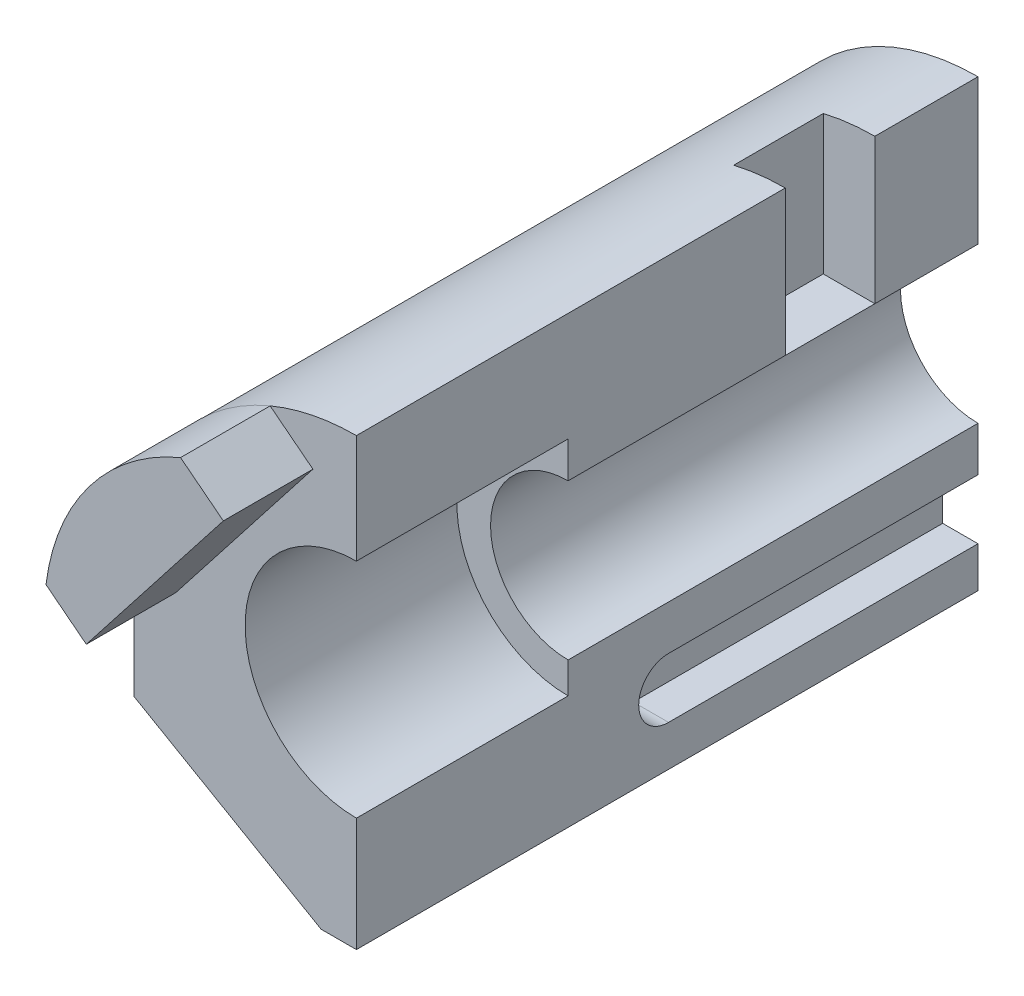
from build123d import *

# Parameters (mm, degrees)
BOSS_EXTRUDE1_DEPTH = 229
BOSS_EXTRUDE3_DEPTH = 33
CUT_EXTRUDE1_DEPTH  = 78
SKETCH4_W           = 33
SKETCH4_H           = 53.425
CUT_EXTRUDE2_DEPTH  = 19
CUT_EXTRUDE3_DEPTH  = 13


with BuildPart() as part:
    # Sketch1 → Boss-Extrude1 (new body)
    with BuildSketch(Plane.XY):
        with BuildLine():
            Line((0, 42.162831426), (0, 0))
            Line((0, 0), (69, -39.837168574))
            Line((69, -39.837168574), (82, -39.837168574))
            Line((82, -39.837168574), (82, 13.587831426))
            ThreePointArc((82, 13.587831426), (53.425, 42.162831426), (82, 70.737831426))
            Line((82, 70.737831426), (82, 124.162831426))
            ThreePointArc((82, 124.162831426), (24.017243943, 100.145587483), (0, 42.162831426))
        make_face()
    extrude(amount=BOSS_EXTRUDE1_DEPTH)

    # Sketch2 → Boss-Extrude3 (add)
    with BuildSketch(Plane.XY.offset(229)):
        with BuildLine():
            Line((50.218978157, 117.75361559), (65.979193229, 105.440386084))
            Line((65.979193229, 105.440386084), (15.494952252, 40.823504288))
            Line((15.494952252, 40.823504288), (0.644773941, 52.425735154))
            ThreePointArc((0.644773941, 52.425735154), (16.616037222, 91.779593848), (50.218978157, 117.75361559))
        make_face()
    extrude(amount=BOSS_EXTRUDE3_DEPTH)

    # Sketch3 → Cut-Extrude1 (cut)
    with BuildSketch(Plane.XY.offset(229)):
        with BuildLine():
            Line((82, 84.108352132), (82, 2.108352132))
            ThreePointArc((82, 2.108352132), (41, 43.108352132), (82, 84.108352132))
        make_face()
    extrude(amount=-CUT_EXTRUDE1_DEPTH, mode=Mode.SUBTRACT)

    # Sketch4 → Cut-Extrude2 (cut)
    with BuildSketch(Plane(origin=(82, 0, 0), x_dir=(0, 0, -1), z_dir=(1, 0, 0))):
        with Locations((-54.5, 97.450331426)):
            Rectangle(SKETCH4_W, SKETCH4_H)
    extrude(amount=-CUT_EXTRUDE2_DEPTH, mode=Mode.SUBTRACT)

    # Sketch5 → Cut-Extrude3 (cut)
    with BuildSketch(Plane(origin=(82, 0, 0), x_dir=(0, 0, -1), z_dir=(1, 0, 0))):
        with BuildLine():
            Line((0, -24.837168574), (-114, -24.837168574))
            ThreePointArc((-114, -24.837168574), (-125, -13.837168574), (-114, -2.837168574))
            Line((-114, -2.837168574), (0, -2.837168574))
            ThreePointArc((0, -2.837168574), (11, -13.837168574), (0, -24.837168574))
        make_face()
    extrude(amount=-CUT_EXTRUDE3_DEPTH, mode=Mode.SUBTRACT)


solid = part.part
